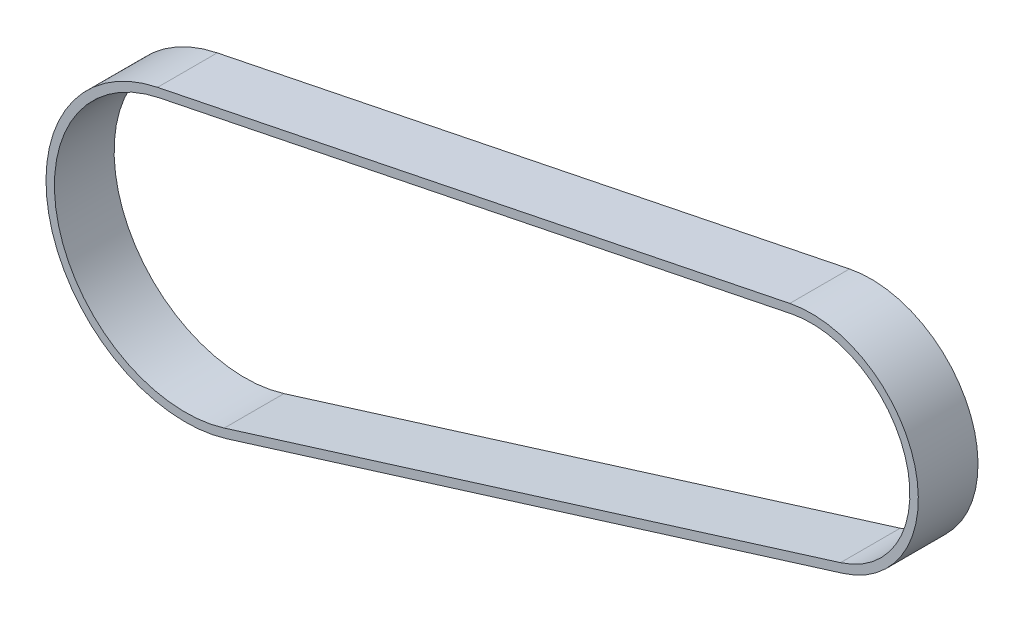
from build123d import *

# Parameters (mm, degrees)
EXTRUDE_THIN1_DEPTH = 9


with BuildPart() as part:
    # Sketch2 → Extrude-Thin1 (new body)
    with BuildSketch(Plane.XY):
        with BuildLine():
            Line((109.542231626, 21.6191135), (16.639703964, -7.258081285))
            ThreePointArc((16.639703964, -7.258081285), (-9.959186734, 7.58720251), (6.198017516, 33.410219145))
            Line((6.198017516, 33.410219145), (101.520959889, 52.860378067))
            ThreePointArc((101.520959889, 52.860378067), (120.389467306, 41.054540952), (109.542231626, 21.6191135))
        make_face()
        with BuildLine():
            Line((109.165264356, 22.831877153), (16.262736694, -6.045317632))
            ThreePointArc((16.262736694, -6.045317632), (-8.729084965, 7.903034173), (6.451922834, 32.165859033))
            Line((6.451922834, 32.165859033), (101.774865207, 51.616017955))
            ThreePointArc((101.774865207, 51.616017955), (119.159365537, 40.738709289), (109.165264356, 22.831877153))
        make_face(mode=Mode.SUBTRACT)
    extrude(amount=EXTRUDE_THIN1_DEPTH)


solid = part.part
